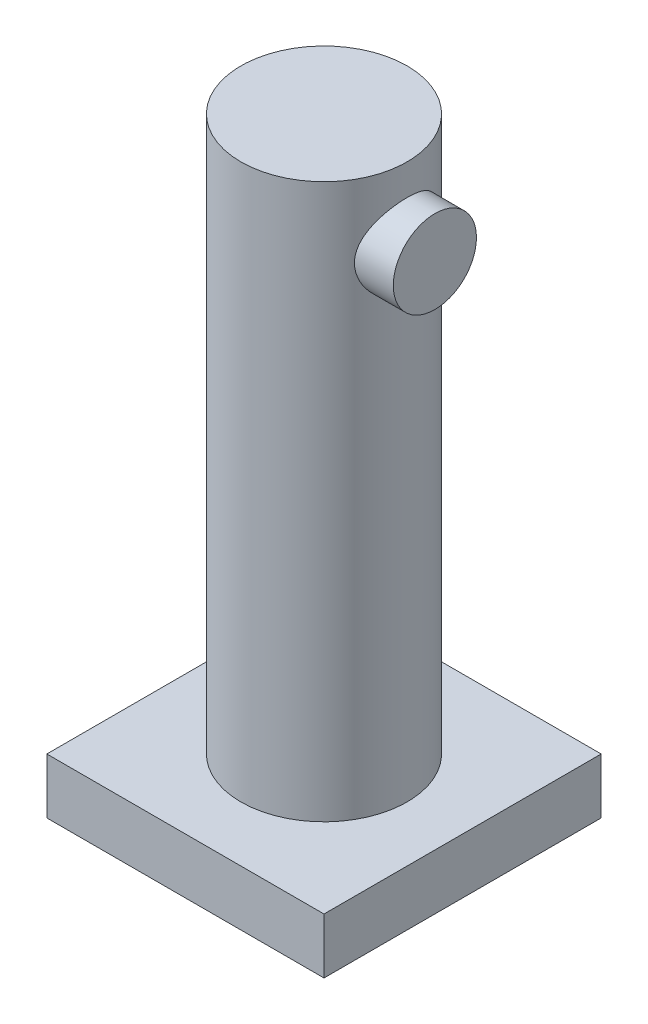
from build123d import *

# Parameters (mm, degrees)
CROQUIS2_W              = 500
CROQUIS2_H              = 500
SALIENTE_EXTRUIR1_DEPTH = 100
CROQUIS3_R              = 150
SALIENTE_EXTRUIR2_DEPTH = 1000
CROQUIS5_R              = 75
SALIENTE_EXTRUIR4_DEPTH = 200


with BuildPart() as part:
    # Croquis2 → Saliente-Extruir1 (new body)
    with BuildSketch(Plane(origin=(0, 0, 0), x_dir=(1, 0, 0), z_dir=(0, 1, 0))):
        Rectangle(CROQUIS2_W, CROQUIS2_H)
    extrude(amount=SALIENTE_EXTRUIR1_DEPTH)

    # Croquis3 → Saliente-Extruir2 (add)
    with BuildSketch(Plane(origin=(0, 100, 0), x_dir=(1, 0, 0), z_dir=(0, 1, 0))):
        with Locations(Location((0, 0, 0), (0, 0, 270))):
            Circle(CROQUIS3_R)
    extrude(amount=SALIENTE_EXTRUIR2_DEPTH)

    # Croquis5 → Saliente-Extruir4 (add)
    with BuildSketch(Plane(origin=(0, 0, 0), x_dir=(0, 0, -1), z_dir=(1, 0, 0))):
        with Locations(Location((0, 969.265591665, 0), (0, 0, 180))):
            Circle(CROQUIS5_R)
    extrude(amount=SALIENTE_EXTRUIR4_DEPTH)


solid = part.part
